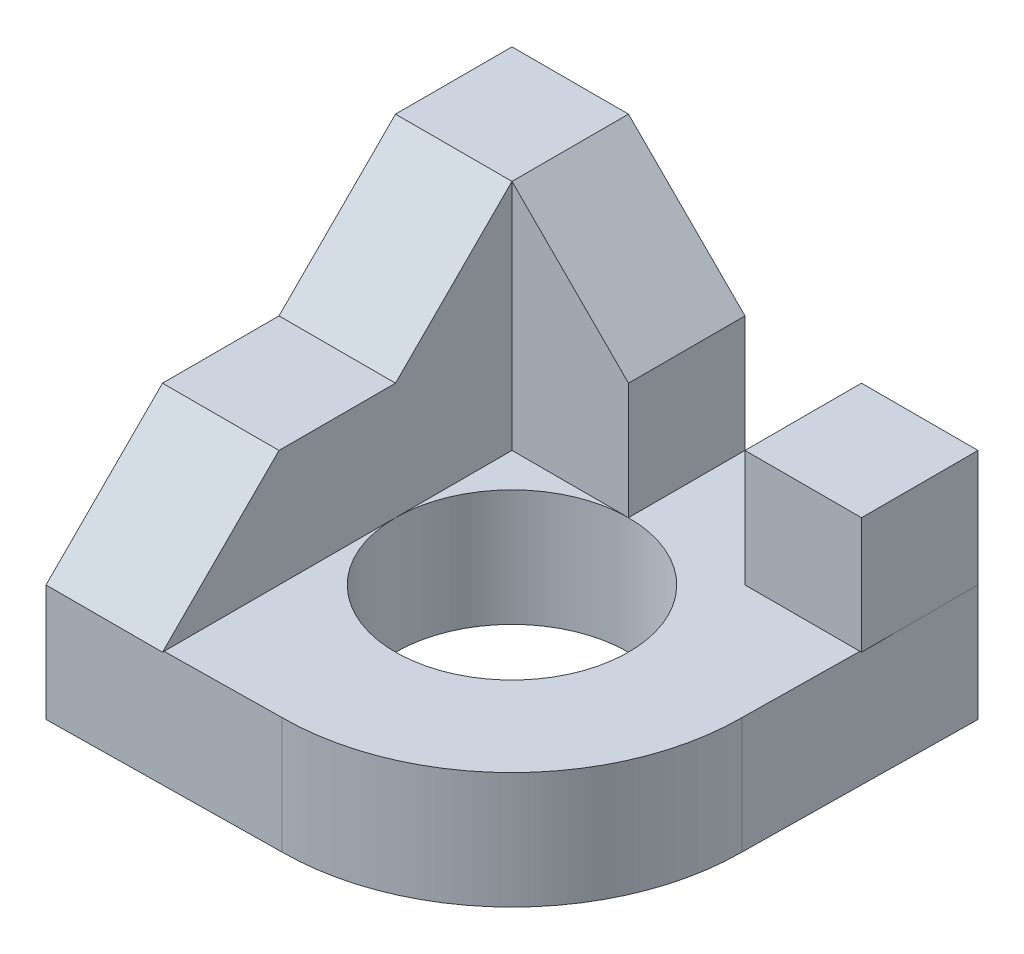
from build123d import *

# Parameters (mm, degrees)
SKETCH1_R           = 10
BOSS_EXTRUDE1_DEPTH = 10
BOSS_EXTRUDE2_DEPTH = 10
SKETCH3_W           = 10
SKETCH3_H           = 10
BOSS_EXTRUDE3_DEPTH = 10


with BuildPart() as part:
    # Sketch1 → Boss-Extrude1 (new body)
    with BuildSketch(Plane(origin=(0, 0, 0), x_dir=(1, 0, 0), z_dir=(0, 1, 0))):
        with BuildLine():
            Line((-27.984790875, 21.292775665), (-27.984790875, -18.707224335))
            Line((-27.984790875, -18.707224335), (-7.984790875, -18.436045575))
            ThreePointArc((-7.984790875, -18.436045575), (5.96559241, -12.657607619), (11.744030366, 1.292775665))
            Line((11.744030366, 1.292775665), (12.015209125, 21.292775665))
            Line((12.015209125, 21.292775665), (-27.984790875, 21.292775665))
        make_face()
        with Locations(Location((-7.984790875, 1.292775665, 0), (0, 0, 270))):
            Circle(SKETCH1_R, mode=Mode.SUBTRACT)
    extrude(amount=BOSS_EXTRUDE1_DEPTH)

    # Sketch2 → Boss-Extrude2 (add)
    with BuildSketch(Plane.ZY.offset(27.984790875)):
        Polygon((18.707224335, 10), (8.707224335, 20), (-1.292775665, 20), (-11.292775665, 30), (-21.292775665, 30), (-21.292775665, 10), align=None)
    extrude(amount=-BOSS_EXTRUDE2_DEPTH)

    # Sketch3 → Boss-Extrude3 (add)
    with BuildSketch(Plane(origin=(0, 0, -21.292775665), x_dir=(-1, 0, 0), z_dir=(0, 0, -1))):
        Polygon((17.984790875, 30), (17.984790875, 10), (7.984790875, 10), (7.984790875, 20), align=None)
        with Locations((-7.015209125, 15)):
            Rectangle(SKETCH3_W, SKETCH3_H)
    extrude(amount=-BOSS_EXTRUDE3_DEPTH)


solid = part.part
